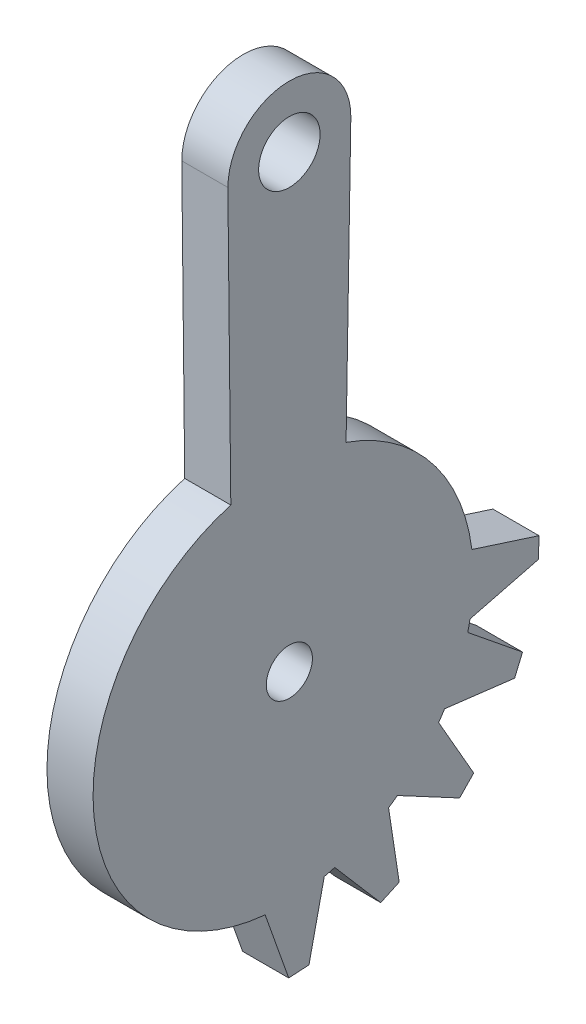
from build123d import *

# Parameters (mm, degrees)
SKETCH_1_R      = 2
SKETCH_1_R_2    = 1.5
EXTRUDE_2_DEPTH = 3


with BuildPart() as part:
    # ｽｹｯﾁ1 → ﾎﾞｽ - 押し出し2 (new body)
    with BuildSketch(Plane(origin=(0, 0, 0), x_dir=(0, 0, -1), z_dir=(1, 0, 0))):
        with BuildLine():
            ThreePointArc((79.516381724, 17.875328128), (75.516381724, 21.875328128), (71.516381724, 17.875328128))
            Line((71.516381724, 17.875328128), (71.707016231, -0.114604955))
            ThreePointArc((71.707016231, -0.114604955), (62.797189361, -13.143986116), (73.940663181, -24.323108598))
            Line((73.940663181, -24.323108598), (75.474683518, -28.648291112))
            Line((75.474683518, -28.648291112), (76.792060343, -28.56761025))
            Line((76.792060343, -28.56761025), (77.786816557, -24.087556428))
            ThreePointArc((77.786816557, -24.087556428), (78.129155766, -24.006767492), (78.469059941, -23.916279163))
            Line((78.469059941, -23.916279163), (81.461927443, -27.395239681))
            Line((81.461927443, -27.395239681), (82.661199459, -26.844115619))
            Line((82.661199459, -26.844115619), (81.970399896, -22.307242452))
            ThreePointArc((81.970399896, -22.307242452), (82.260437372, -22.108241826), (82.544700421, -21.901076422))
            Line((82.544700421, -21.901076422), (86.592211747, -24.063962049))
            Line((86.592211747, -24.063962049), (87.511410622, -23.116827145))
            Line((87.511410622, -23.116827145), (85.228351592, -19.135864493))
            ThreePointArc((85.228351592, -19.135864493), (85.426916166, -18.845528315), (85.61714679, -18.549664671))
            Line((85.61714679, -18.549664671), (90.172663107, -19.104365719))
            Line((90.172663107, -19.104365719), (90.687645941, -17.889135789))
            Line((90.687645941, -17.889135789), (87.120667215, -15.001734719))
            ThreePointArc((87.120667215, -15.001734719), (87.200941642, -14.659274498), (87.27144814, -14.314670639))
            Line((87.27144814, -14.314670639), (91.719721727, -13.186271657))
            Line((91.719721727, -13.186271657), (91.760937233, -11.867070238))
            Line((91.760937233, -11.867070238), (87.391779056, -10.463190263))
            ThreePointArc((87.391779056, -10.463190263), (84.740310623, -4.232469554), (79.205934948, -0.330822302))
            Line((79.205934948, -0.330822302), (79.516381724, 17.875328128))
        make_face()
        with Locations((75.516381724, 17.875328128)):
            Circle(SKETCH_1_R, mode=Mode.SUBTRACT)
        with Locations((75.516381724, -11.404671872)):
            Circle(SKETCH_1_R_2, mode=Mode.SUBTRACT)
    extrude(amount=EXTRUDE_2_DEPTH)


solid = part.part
